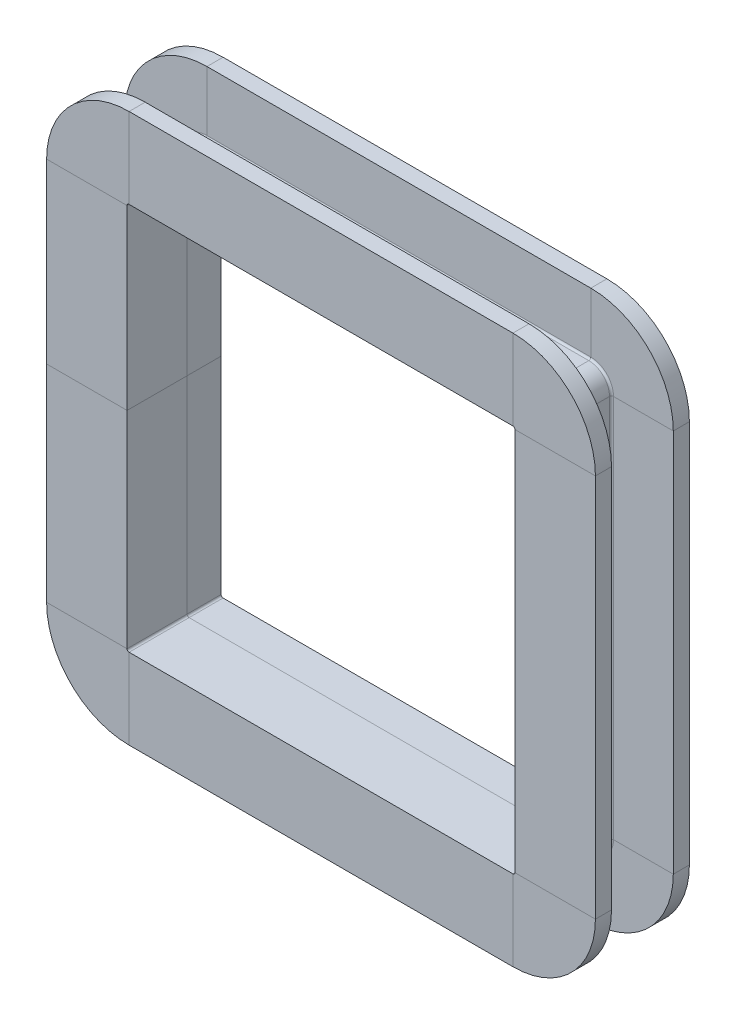
from build123d import *


with BuildPart() as part:
    # Sweep1: sweep along a path in Sketch4
    with BuildLine(Plane.XY) as sweep1_path:
        Line((0, -65.154874543), (0, 56.003125457))
        ThreePointArc((0, 56.003125457), (0.185987194, 56.452138263), (0.635, 56.638125457))
        Line((0.635, 56.638125457), (121.793, 56.638125457))
        ThreePointArc((121.793, 56.638125457), (122.242012806, 56.452138263), (122.428, 56.003125457))
        Line((122.428, 56.003125457), (122.428, -65.154874543))
        ThreePointArc((122.428, -65.154874543), (122.242012806, -65.603887349), (121.793, -65.789874543))
        Line((121.793, -65.789874543), (0.635, -65.789874543))
        ThreePointArc((0.635, -65.789874543), (0.185987194, -65.603887349), (0, -65.154874543))
    # Sketch3 → Sweep1 (sweep)
    with BuildSketch(Plane(origin=(0, 0, 0), x_dir=(1, 0, 0), z_dir=(0, 1, 0))):
        with BuildLine():
            Line((0, 0), (0, 10.72500014))
            Line((0, 10.72500014), (-25.4, 10.72500014))
            Line((-25.4, 10.72500014), (-25.4, 5.64500014))
            Line((-25.4, 5.64500014), (-6.535, 5.64500014))
            ThreePointArc((-6.535, 5.64500014), (-6.085987194, 5.459012946), (-5.9, 5.01000014))
            Line((-5.9, 5.01000014), (-5.9, -13.21999986))
            ThreePointArc((-5.9, -13.21999986), (-6.085987194, -13.669012666), (-6.535, -13.85499986))
            Line((-6.535, -13.85499986), (-25.4, -13.85499986))
            Line((-25.4, -13.85499986), (-25.4, -18.93499986))
            Line((-25.4, -18.93499986), (0, -18.93499986))
            Line((0, -18.93499986), (0, 0))
        make_face()
    sweep(path=sweep1_path.line)


solid = part.part
